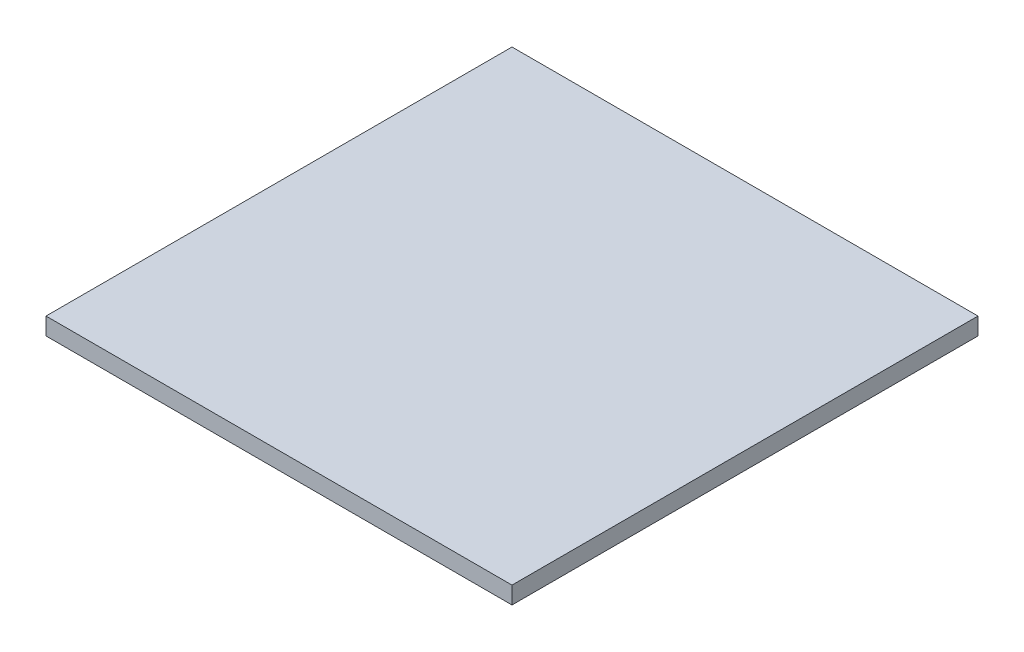
from build123d import *

# Parameters (mm, degrees)
SKETCH1_W           = 270
SKETCH1_H           = 270
BOSS_EXTRUDE1_DEPTH = 10


with BuildPart() as part:
    # Sketch1 → Boss-Extrude1 (new body)
    with BuildSketch(Plane(origin=(0, 0, 0), x_dir=(1, 0, 0), z_dir=(0, 1, 0))):
        Rectangle(SKETCH1_W, SKETCH1_H)
    extrude(amount=BOSS_EXTRUDE1_DEPTH)


solid = part.part
